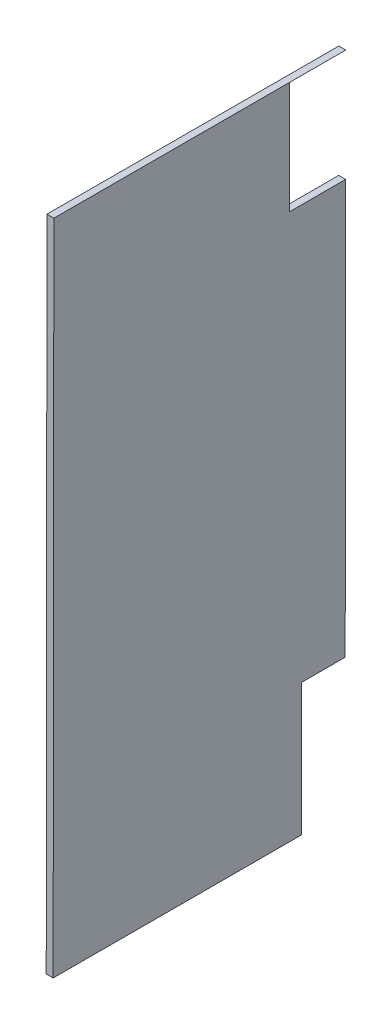
from build123d import *

# Parameters (mm, degrees)
BOSS_EXTRUDE1_DEPTH = 5.08
SKETCH11_W          = 41.321018404
SKETCH11_H          = 82.171066474
SKETCH11_W_2        = 64.858701062
SKETCH11_H_2        = 131.277002868
CUT_EXTRUDE1_DEPTH  = 1593.302629235


with BuildPart() as part:
    # Sketch5 → Boss-Extrude1 (new body)
    with BuildSketch(Plane(origin=(0, 0, 0), x_dir=(0, 0, -1), z_dir=(1, 0, 0))):
        Polygon((-1.661660189, 1095.375698265), (212.544479643, 1095.145979446), (213.062028944, 1577.745701931), (-1.144110888, 1577.97542075), align=None)
    extrude(amount=BOSS_EXTRUDE1_DEPTH)

    # Sketch11 → Cut-Extrude1 (cut, through all)
    with BuildSketch(Plane(origin=(5.08, 0, 0), x_dir=(0, 0, -1), z_dir=(1, 0, 0))):
        with Locations((192.401519742, 1536.660168694)):
            Rectangle(SKETCH11_W, SKETCH11_H)
        with Locations((212.838086125, 1126.439608027)):
            Rectangle(SKETCH11_W_2, SKETCH11_H_2)
    extrude(amount=-CUT_EXTRUDE1_DEPTH, mode=Mode.SUBTRACT)


solid = part.part
